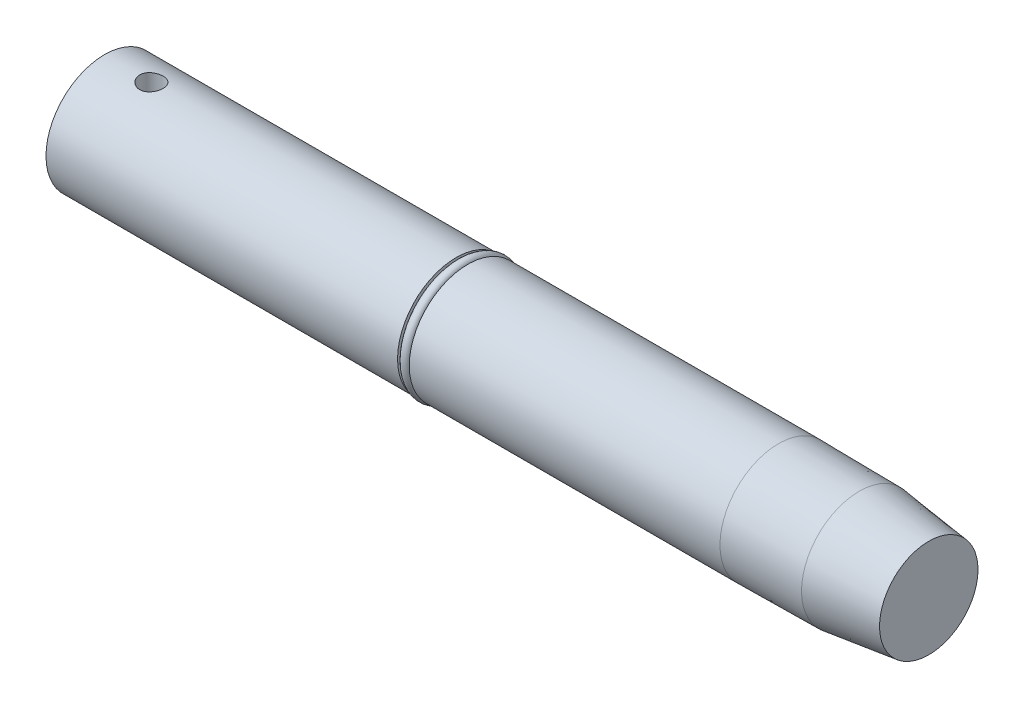
from build123d import *

# Parameters (mm, degrees)
SKETCH1_R               = 15
BOSS_EXTRUDE1_DEPTH     = 211
CUT_EXTRUDE1_DEPTH      = 199
CUT_EXTRUDE1_DEPTH_BACK = 199
SKETCH2_R               = 3
CHAMFER1_SIZE           = 2
CHAMFER1_SIZE2          = 17.797060577
SKETCH4_W               = 3
SKETCH4_H               = 2.1
SKETCH5_R               = 1.2


with BuildPart() as part:
    # Sketch1 → Boss-Extrude1 (new body)
    with BuildSketch(Plane(origin=(0, 0, 0), x_dir=(0, 0, -1), z_dir=(1, 0, 0))):
        Circle(SKETCH1_R)
    extrude(amount=BOSS_EXTRUDE1_DEPTH)

    # Sketch2 → Cut-Extrude1 (cut, two sides: drawn at the far end of the back side and taken through both)
    with BuildSketch(Plane(origin=(0, 0, 0), x_dir=(1, 0, 0), z_dir=(0, 1, 0)).offset(-CUT_EXTRUDE1_DEPTH_BACK)):
        with Locations((12, 0)):
            Circle(SKETCH2_R)
    extrude(amount=CUT_EXTRUDE1_DEPTH + CUT_EXTRUDE1_DEPTH_BACK, mode=Mode.SUBTRACT)

    # Sketch3 → Cut-Revolve1 (revolve, cut)
    with BuildSketch(Plane.XY):
        Polygon((172.539848215, 15), (211, 14.6), (211, 15), align=None)
    revolve(axis=Axis((-16.667953377, 0, 0), (1, 0, 0)), mode=Mode.SUBTRACT)

    # Chamfer1
    chamfer1_edges = [part.edges().sort_by_distance(p)[0] for p in [
        (211, -14.6, 0),
    ]]
    chamfer1_side = [part.faces().sort_by_distance(p)[0] for p in [
        (211, 0, 0),
    ]]
    chamfer(chamfer1_edges, length=CHAMFER1_SIZE, length2=CHAMFER1_SIZE2, reference=chamfer1_side[0])

    # Sketch4 → Cut-Revolve2 (revolve, cut)
    with BuildSketch(Plane.XY):
        with Locations((91.5, 13.95)):
            Rectangle(SKETCH4_W, SKETCH4_H)
    revolve(axis=Axis((98.888949173, 0, 0), (1, 0, 0)), mode=Mode.SUBTRACT)


with BuildPart() as body_2:
    # Sketch5 → Revolve1 (revolve)
    with BuildSketch(Plane.XY):
        with Locations((91.525064223, 14.197033875)):
            Circle(SKETCH5_R)
    revolve(axis=Axis((65.206032182, 0, 0), (1, 0, 0)))


solid = Compound([part.part, body_2.part])
